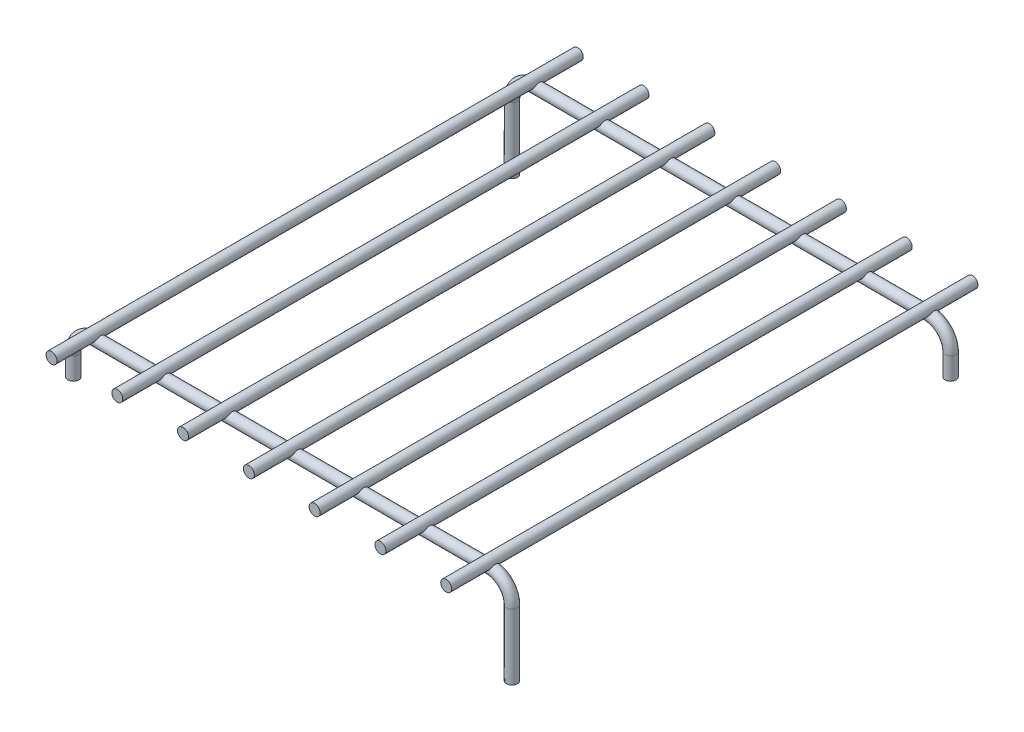
from build123d import *
from build123d.topology import SkipClean

# Parameters (mm, degrees)
SKETCH2_R           = 1.5875
LPATTERN1_COUNT     = 2
LPATTERN1_PITCH     = 127
EXTRUDE1_DEPTH      = 12.7
EXTRUDE1_DEPTH_BACK = 139.7
SKETCH3_R           = 1.5875
LPATTERN2_COUNT     = 4
LPATTERN2_PITCH     = 19.05
LPATTERN2_2_COUNT   = 4
LPATTERN2_2_PITCH   = 19.05
SKETCH4_R           = 1.5875
EXTRUDE2_DEPTH      = 12.7
SKETCH5_R           = 1.5875
CUT_EXTRUDE1_DEPTH  = 12.7


with BuildPart() as part:
    # Sweep1: sweep along a path in Sketch1
    with BuildLine(Plane.XY) as sweep1_path:
        Line((-63.5, -12.7), (-63.5, -6.35))
        ThreePointArc((-63.5, -6.35), (-61.640128061, -1.859871939), (-57.15, 0))
        Line((-57.15, 0), (57.15, 0))
        ThreePointArc((57.15, 0), (61.640128061, -1.859871939), (63.5, -6.35))
        Line((63.5, -6.35), (63.5, -25.4))
    # Sketch2 → Sweep1 (sweep)
    with BuildSketch(Plane(origin=(-63.5, -12.7, 0), x_dir=(-1, 0, 0), z_dir=(0, 1, 0))):
        Circle(SKETCH2_R)
    sweep(path=sweep1_path.line)


with BuildPart() as lpattern1_1:
    # LPattern1: pattern copy
    add(part.part.moved(Location(Vector(0, 0, -1) * (1 * LPATTERN1_PITCH))))


with BuildPart() as body_3:
    # Sketch3 → Extrude1 (new, two sides: drawn at the far end of the back side and taken through both)
    with BuildSketch(Plane.XY.offset(-EXTRUDE1_DEPTH_BACK)):
        with Locations((0, 1.5875)):
            Circle(SKETCH3_R)
    extrude(amount=EXTRUDE1_DEPTH + EXTRUDE1_DEPTH_BACK)


with BuildPart() as lpattern2_1:
    # LPattern2: pattern copy
    add(body_3.part.moved(Location(Vector(1, 0, 0) * (1 * LPATTERN2_PITCH))))


with BuildPart() as lpattern2_2:
    # LPattern2: pattern copy
    add(body_3.part.moved(Location(Vector(1, 0, 0) * (2 * LPATTERN2_PITCH))))


with BuildPart() as lpattern2_3:
    # LPattern2: pattern copy
    add(body_3.part.moved(Location(Vector(1, 0, 0) * (3 * LPATTERN2_PITCH))))


with BuildPart() as lpattern2_2_1:
    # LPattern2 2: pattern copy
    add(body_3.part.moved(Location(Vector(-1, 0, 0) * (1 * LPATTERN2_2_PITCH))))


with BuildPart() as lpattern2_2_2:
    # LPattern2 2: pattern copy
    add(body_3.part.moved(Location(Vector(-1, 0, 0) * (2 * LPATTERN2_2_PITCH))))


with BuildPart() as lpattern2_2_3:
    # LPattern2 2: pattern copy
    add(body_3.part.moved(Location(Vector(-1, 0, 0) * (3 * LPATTERN2_2_PITCH))))


with BuildPart() as part_1:
    add(part.part)

    # Combine1: union LPattern1_1, body 3, LPattern2_1, LPattern2_2, LPattern2_3, LPattern2 2_1, LPattern2 2_2, LPattern2 2_3
    add(lpattern1_1.part)
    add(body_3.part)
    add(lpattern2_1.part)
    add(lpattern2_2.part)
    add(lpattern2_3.part)
    add(lpattern2_2_1.part)
    add(lpattern2_2_2.part)
    add(lpattern2_2_3.part)

    # Sketch4 → Extrude2 (add)
    with BuildSketch(Plane.XZ.offset(12.7)):
        with Locations((-63.5, -127)):
            Circle(SKETCH4_R)
    extrude(amount=EXTRUDE2_DEPTH)

    # Sketch5 → Cut-Extrude1 (cut)
    with BuildSketch(Plane.XZ.offset(25.4)):
        with Locations(Location((63.5, -127, 0), (0, 0, 180))):
            Circle(SKETCH5_R)
    extrude(amount=-CUT_EXTRUDE1_DEPTH, mode=Mode.SUBTRACT)


solid = part_1.part
